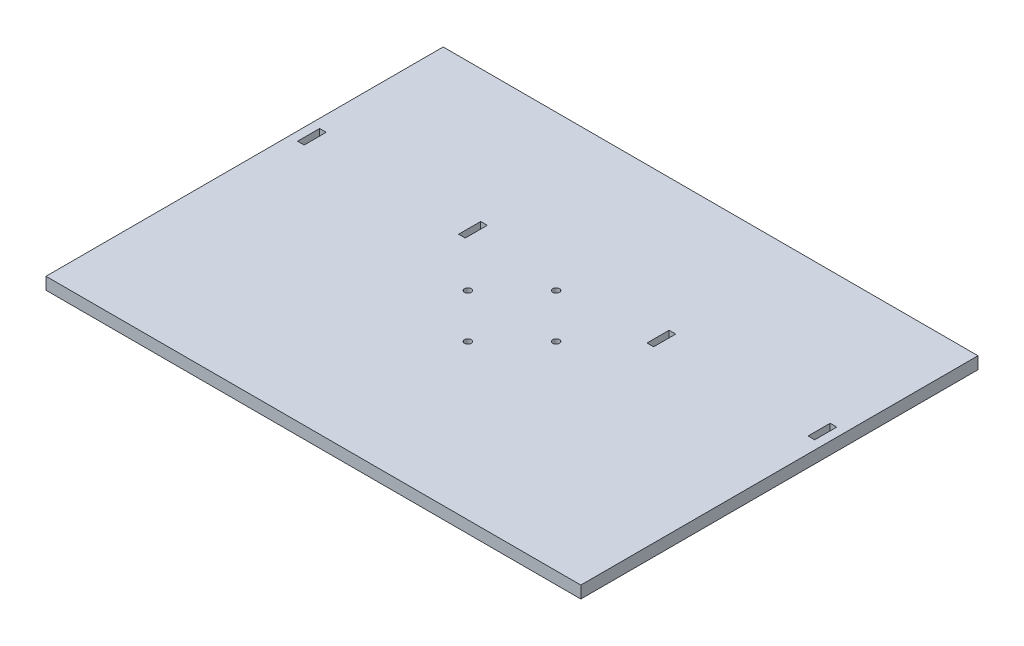
from build123d import *

# Parameters (mm, degrees)
CROQUIS1_W              = 140
CROQUIS1_H              = 110
CROQUIS1_R              = 1.75
CROQUIS1_R_2            = 1.7
SALIENTE_EXTRUIR1_DEPTH = 6
REDONDEO1_R             = 8
REDONDEO2_R             = 8
CROQUIS2_W              = 42.672269
CROQUIS2_H              = 112.197382
CORTAR_EXTRUIR1_DEPTH   = 10
CROQUIS3_W              = 36.240418
CROQUIS3_H              = 110
SALIENTE_EXTRUIR2_DEPTH = 6
CROQUIS4_W              = 130
CROQUIS4_H              = 44.342948
CROQUIS4_H_2            = 44.315965
SALIENTE_EXTRUIR3_DEPTH = 6
REDONDEO3_R             = 10
REDONDEO4_R             = 10
CORTAR_EXTRUIR2_START   = -10
CORTAR_EXTRUIR2_DEPTH   = 10
SALIENTE_EXTRUIR4_START = -6
SALIENTE_EXTRUIR4_DEPTH = 6
CROQUIS7_W              = 242.381537
CROQUIS7_H              = 180
SALIENTE_EXTRUIR5_DEPTH = 5.5
CROQUIS8_R              = 1.5
CORTAR_EXTRUIR3_DEPTH   = 5.5
CROQUIS9_W              = 227.16044
CROQUIS9_H              = 250.882891
CORTAR_EXTRUIR5_DEPTH   = 6
CROQUIS10_W             = 3
CROQUIS10_H             = 10
CORTAR_EXTRUIR6_DEPTH   = 6


with BuildPart() as part:
    # Croquis1 → Saliente-Extruir1 (new body)
    with BuildSketch(Plane(origin=(0, 0, 0), x_dir=(1, 0, 0), z_dir=(0, 1, 0))):
        Rectangle(CROQUIS1_W, CROQUIS1_H)
        with Locations(Location((0, 20, 0), (0, 0, 270))):
            Circle(CROQUIS1_R, mode=Mode.SUBTRACT)
        with Locations(Location((20, 0, 0), (0, 0, 270))):
            Circle(CROQUIS1_R_2, mode=Mode.SUBTRACT)
        with Locations(Location((-20, 0, 0), (0, 0, 270))):
            Circle(CROQUIS1_R_2, mode=Mode.SUBTRACT)
        with Locations(Location((0, -20, 0), (0, 0, 270))):
            Circle(CROQUIS1_R_2, mode=Mode.SUBTRACT)
    extrude(amount=SALIENTE_EXTRUIR1_DEPTH)

    # Redondeo1
    redondeo1_edges = [part.edges().sort_by_distance(p)[0] for p in [
        (70, 3, 55),
        (-70, 3, 55),
        (-70, 3, -55),
    ]]
    fillet(redondeo1_edges, radius=REDONDEO1_R)

    # Redondeo2
    redondeo2_edges = [part.edges().sort_by_distance(p)[0] for p in [
        (70, 3, -55),
    ]]
    fillet(redondeo2_edges, radius=REDONDEO2_R)

    # Croquis2 → Cortar-Extruir1 (cut)
    with BuildSketch(Plane(origin=(0, 6, 0), x_dir=(1, 0, 0), z_dir=(0, 1, 0))):
        with Locations((-64.336135, -1.098691)):
            Rectangle(CROQUIS2_W, CROQUIS2_H)
    extrude(amount=-CORTAR_EXTRUIR1_DEPTH, mode=Mode.SUBTRACT)

    # Croquis3 → Saliente-Extruir2 (add)
    with BuildSketch(Plane(origin=(0, 6, 0), x_dir=(1, 0, 0), z_dir=(0, 1, 0))):
        with Locations((68.879791, 0)):
            Rectangle(CROQUIS3_W, CROQUIS3_H)
    extrude(amount=-SALIENTE_EXTRUIR2_DEPTH)

    # Croquis4 → Saliente-Extruir3 (add)
    with BuildSketch(Plane(origin=(0, 6, 0), x_dir=(1, 0, 0), z_dir=(0, 1, 0))):
        with Locations((22, -64.828526)):
            Rectangle(CROQUIS4_W, CROQUIS4_H)
        with Locations((22, 64.842017)):
            Rectangle(CROQUIS4_W, CROQUIS4_H_2)
    extrude(amount=-SALIENTE_EXTRUIR3_DEPTH)

    # Redondeo3
    redondeo3_edges = [part.edges().sort_by_distance(p)[0] for p in [
        (-43, 3, 87),
        (87, 3, 87),
        (87, 3, -87),
    ]]
    fillet(redondeo3_edges, radius=REDONDEO3_R)

    # Redondeo4
    redondeo4_edges = [part.edges().sort_by_distance(p)[0] for p in [
        (-43, 3, -87),
    ]]
    fillet(redondeo4_edges, radius=REDONDEO4_R)

    # Croquis5 → Cortar-Extruir2 (cut)
    with BuildSketch(Plane(origin=(0, 6, 0), x_dir=(1, 0, 0), z_dir=(0, 1, 0)).offset(CORTAR_EXTRUIR2_START)):
        with BuildLine():
            Line((77, 87), (23.043437, 87))
            ThreePointArc((23.043437, 87), (63.63961, 63.63961), (87, 23.043437))
            Line((87, 23.043437), (87, 77))
            ThreePointArc((87, 77), (84.071068, 84.071068), (77, 87))
        make_face()
        with BuildLine():
            ThreePointArc((87, -23.043437), (63.63961, -63.63961), (23.043437, -87))
            Line((23.043437, -87), (77, -87))
            ThreePointArc((77, -87), (84.071068, -84.071068), (87, -77))
            Line((87, -77), (87, -23.043437))
        make_face()
        with BuildLine():
            ThreePointArc((-33, 87), (-39.24681, 84.8088), (-42.756019, 79.195473))
            ThreePointArc((-42.756019, 79.195473), (-33.130345, 83.680226), (-23.043437, 87))
            Line((-23.043437, 87), (-33, 87))
        make_face()
        with BuildLine():
            ThreePointArc((-23.043437, -87), (-33.130345, -83.680226), (-42.756019, -79.195473))
            ThreePointArc((-42.756019, -79.195473), (-39.24681, -84.8088), (-33, -87))
            Line((-33, -87), (-23.043437, -87))
        make_face()
    extrude(amount=CORTAR_EXTRUIR2_DEPTH, mode=Mode.SUBTRACT)

    # Croquis6 → Saliente-Extruir4 (add)
    with BuildSketch(Plane(origin=(0, 6, 0), x_dir=(1, 0, 0), z_dir=(0, 1, 0)).offset(SALIENTE_EXTRUIR4_START)):
        with BuildLine():
            Line((-39.173001, 81.027625), (47.945535, 76.165777))
            ThreePointArc((47.945535, 76.165777), (35.905482, 82.527549), (23.043437, 87))
            Line((23.043437, 87), (-23.043437, 87))
            ThreePointArc((-23.043437, 87), (-31.251218, 84.400008), (-39.173001, 81.027625))
        make_face()
        with BuildLine():
            Line((-23.043437, 87), (23.043437, 87))
            ThreePointArc((23.043437, 87), (0, 90), (-23.043437, 87))
        make_face()
        with BuildLine():
            Line((87, 23.043437), (87, -23.043437))
            ThreePointArc((87, -23.043437), (89.246849, -11.61895), (90, 0))
            ThreePointArc((90, 0), (89.246849, 11.61895), (87, 23.043437))
        make_face()
        with BuildLine():
            Line((72.080644, 53.892308), (75.372333, -49.183446))
            ThreePointArc((75.372333, -49.183446), (82.231494, -36.578427), (87, -23.043437))
            Line((87, -23.043437), (87, 23.043437))
            ThreePointArc((87, 23.043437), (81.022071, 39.184487), (72.080644, 53.892308))
        make_face()
        with BuildLine():
            ThreePointArc((23.043437, -87), (35.905482, -82.527549), (47.945535, -76.165777))
            Line((47.945535, -76.165777), (-35.565619, -82.674583))
            ThreePointArc((-35.565619, -82.674583), (-29.384225, -85.068016), (-23.043437, -87))
            Line((-23.043437, -87), (23.043437, -87))
        make_face()
        with BuildLine():
            ThreePointArc((-23.043437, -87), (0, -90), (23.043437, -87))
            Line((23.043437, -87), (-23.043437, -87))
        make_face()
    extrude(amount=SALIENTE_EXTRUIR4_DEPTH)

    # Croquis7 → Saliente-Extruir5 (add)
    with BuildSketch(Plane(origin=(0, 6, 0), x_dir=(1, 0, 0), z_dir=(0, 1, 0))):
        with Locations((78.25195, 0)):
            Rectangle(CROQUIS7_W, CROQUIS7_H)
    extrude(amount=SALIENTE_EXTRUIR5_DEPTH)

    # Croquis8 → Cortar-Extruir3 (cut)
    with BuildSketch(Plane(origin=(0, 6, 0), x_dir=(-1, 0, 0), z_dir=(0, -1, 0))):
        with Locations(Location((-98.251951, 0, 0), (0, 0, 90))):
            Circle(CROQUIS8_R)
        with Locations(Location((-78.251951, 20, 0), (0, 0, 90))):
            Circle(CROQUIS8_R)
        with Locations(Location((-58.251951, 0, 0), (0, 0, 90))):
            Circle(CROQUIS8_R)
        with Locations(Location((-78.251951, -20, 0), (0, 0, 90))):
            Circle(CROQUIS8_R)
    extrude(amount=-CORTAR_EXTRUIR3_DEPTH, mode=Mode.SUBTRACT)

    # Croquis9 → Cortar-Extruir5 (cut)
    with BuildSketch(Plane(origin=(0, 0, 0), x_dir=(-1, 0, 0), z_dir=(0, -1, 0))):
        with Locations((-10.648317, 7.188622)):
            Rectangle(CROQUIS9_W, CROQUIS9_H)
    extrude(amount=-CORTAR_EXTRUIR5_DEPTH, mode=Mode.SUBTRACT)

    # Croquis10 → Cortar-Extruir6 (cut)
    with BuildSketch(Plane(origin=(0, 6, 0), x_dir=(-1, 0, 0), z_dir=(0, -1, 0))):
        with Locations((37.438818, 25)):
            Rectangle(CROQUIS10_W, CROQUIS10_H)
        with Locations((-193.942719, 25)):
            Rectangle(CROQUIS10_W, CROQUIS10_H)
        with Locations((-35.561182, 25)):
            Rectangle(CROQUIS10_W, CROQUIS10_H)
        with Locations((-120.942719, 25)):
            Rectangle(CROQUIS10_W, CROQUIS10_H)
    extrude(amount=-CORTAR_EXTRUIR6_DEPTH, mode=Mode.SUBTRACT)


solid = part.part
